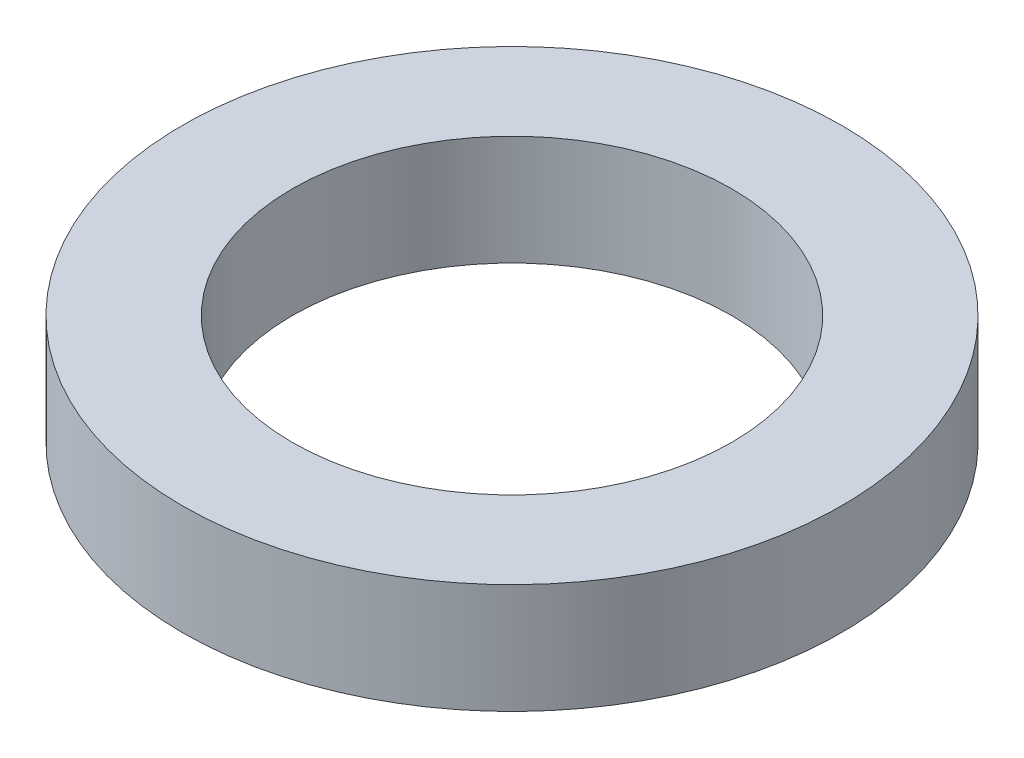
from build123d import *

# Parameters (mm, degrees)
SKETCH1_R           = 1.5
SKETCH1_R_2         = 1
BOSS_EXTRUDE1_DEPTH = 0.5


with BuildPart() as part:
    # Sketch1 → Boss-Extrude1 (new body)
    with BuildSketch(Plane(origin=(0, 0, 0), x_dir=(1, 0, 0), z_dir=(0, 1, 0))):
        with Locations(Location((0, 0, 0), (0, 0, 270))):
            Circle(SKETCH1_R)
        with Locations(Location((0, 0, 0), (0, 0, 270))):
            Circle(SKETCH1_R_2, mode=Mode.SUBTRACT)
    extrude(amount=BOSS_EXTRUDE1_DEPTH)


solid = part.part
